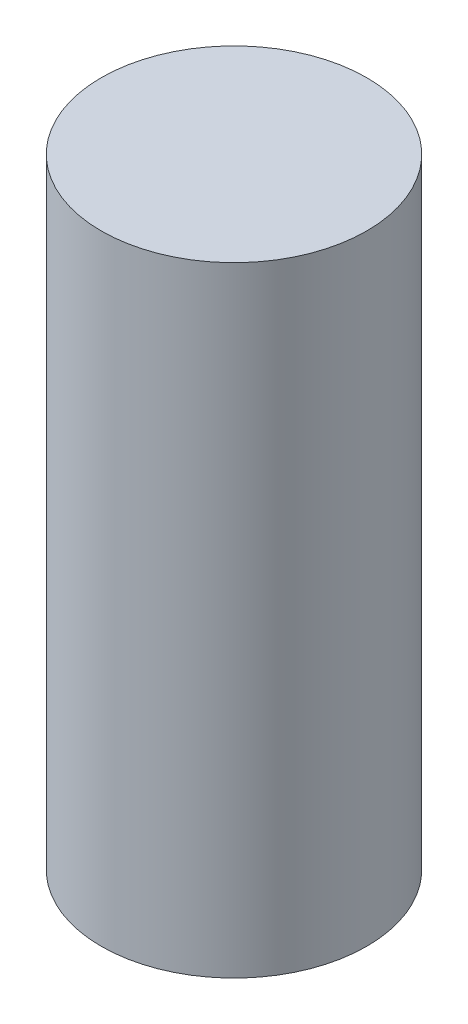
from build123d import *

# Parameters (mm, degrees)
PACK_AYAR_MIL_2_START = 12
SKETCH1_R             = 6
PACK_AYAR_MIL_2_DEPTH = 28


with BuildPart() as part:
    # Sketch1 → PACK_ayar_mil_2 (new body)
    with BuildSketch(Plane(origin=(0, 0, 0), x_dir=(1, 0, 0), z_dir=(0, 1, 0)).offset(PACK_AYAR_MIL_2_START)):
        with Locations(Location((650, 50, 0), (0, 0, 270))):
            Circle(SKETCH1_R)
    extrude(amount=PACK_AYAR_MIL_2_DEPTH)


solid = part.part
